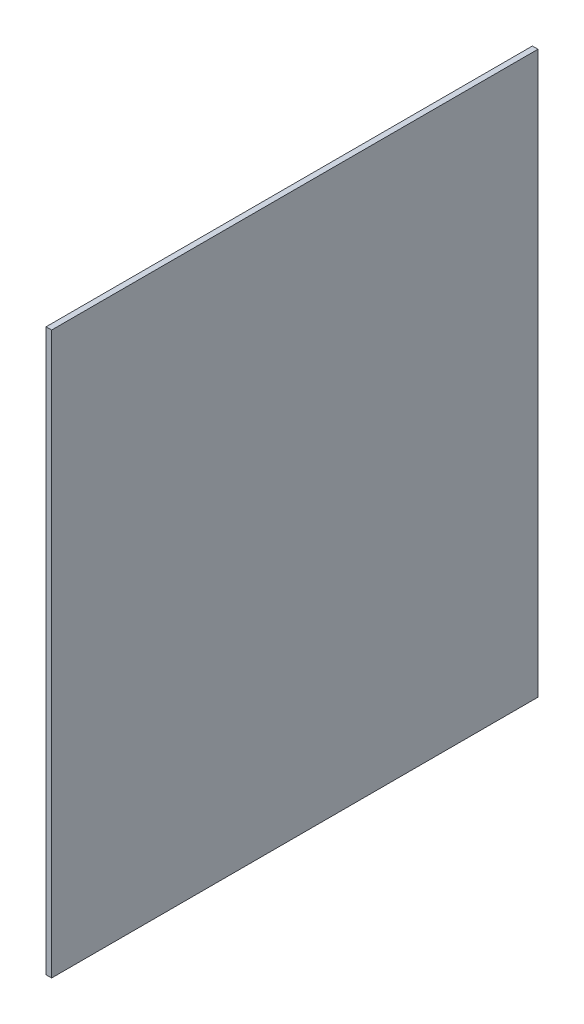
from build123d import *

# Parameters (mm, degrees)
SKETCH1_W           = 260
SKETCH1_H           = 300
BOSS_EXTRUDE2_DEPTH = 3


with BuildPart() as part:
    # Sketch1 → Boss-Extrude2 (new body)
    with BuildSketch(Plane(origin=(0, 0, 0), x_dir=(0, 0, -1), z_dir=(1, 0, 0))):
        with Locations((-118.14516129, -133.935483871)):
            Rectangle(SKETCH1_W, SKETCH1_H)
    extrude(amount=BOSS_EXTRUDE2_DEPTH)


solid = part.part
